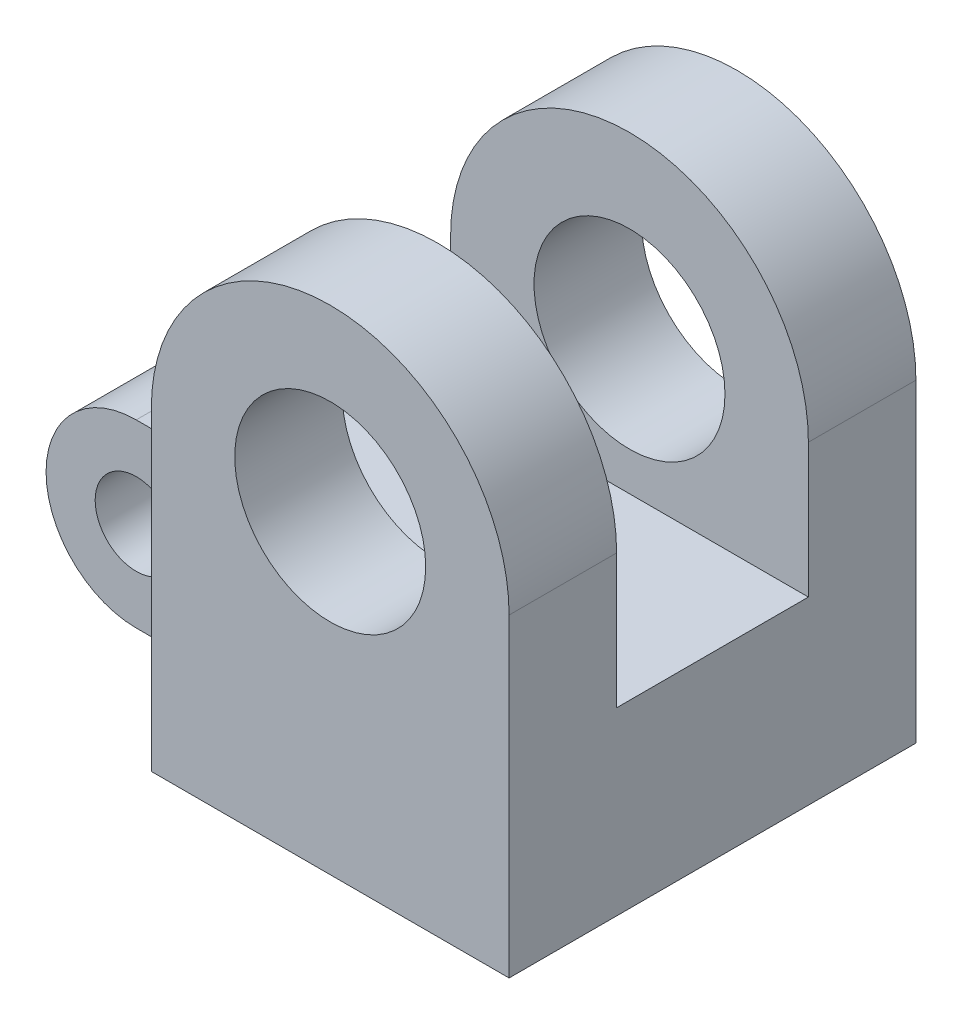
from build123d import *

# Parameters (mm, degrees)
EXTRUDE1_DEPTH     = 8.116924898
SKETCH2_W          = 56.161836645
SKETCH2_H          = 29.756220801
EXTRUDE2_DEPTH     = 3.825672251
SKETCH3_R          = 3.81
EXTRUDE3_DEPTH     = 22.721965672
SKETCH4_R          = 6.425
CUT_EXTRUDE1_DEPTH = 1.27
SKETCH6_R          = 1.638383055
EXTRUDE4_DEPTH     = 3.462479646
EXTRUDE5_DEPTH     = 24.392223233


with BuildPart() as part:
    # Sketch1 → Extrude1 (new, symmetric)
    with BuildSketch(Plane.XY):
        with BuildLine():
            Line((-7.138522943, -12.54381934), (-7.138522943, 0))
            ThreePointArc((-7.138522943, 0), (0, 7.138522943), (7.138522943, 0))
            Line((7.138522943, 0), (7.138522943, -12.54381934))
            Line((7.138522943, -12.54381934), (-7.138522943, -12.54381934))
        make_face()
    extrude(amount=EXTRUDE1_DEPTH, both=True)

    # Sketch2 → Extrude2 (cut, symmetric)
    with BuildSketch(Plane.XY):
        with Locations((-1.286243087, 9.527651968)):
            Rectangle(SKETCH2_W, SKETCH2_H)
    extrude(amount=EXTRUDE2_DEPTH, both=True, mode=Mode.SUBTRACT)

    # Sketch3 → Extrude3 (cut, through all)
    with BuildSketch(Plane.XY.offset(8.116924898)):
        Circle(SKETCH3_R)
    extrude(amount=-EXTRUDE3_DEPTH, mode=Mode.SUBTRACT)

    # Sketch4 → Cut-Extrude1 (cut)
    with BuildSketch(Plane.XZ.offset(12.54381934)):
        Circle(SKETCH4_R)
    extrude(amount=-CUT_EXTRUDE1_DEPTH, mode=Mode.SUBTRACT)

    # Sketch6 → Extrude4 (add, symmetric)
    with BuildSketch(Plane.XY):
        with BuildLine():
            Line((7.138522943, -12.54381934), (7.138522943, -5.350458433))
            Line((7.138522943, -5.350458433), (12.396008331, -5.350458433))
            ThreePointArc((12.396008331, -5.350458433), (15.992688785, -8.947138887), (12.396008331, -12.54381934))
            Line((12.396008331, -12.54381934), (7.138522943, -12.54381934))
        make_face()
        with Locations((12.396008331, -8.947138887)):
            Circle(SKETCH6_R, mode=Mode.SUBTRACT)
    extrude4 = extrude(amount=EXTRUDE4_DEPTH, both=True)

    # Mirror1: Extrude4 across plane
    add(extrude4.mirror(Plane(origin=(0, 0, 0), x_dir=(0, 0, 1), z_dir=(1, 0, 0))))

    # Sketch7 → Extrude5 (cut, through all)
    with BuildSketch(Plane.XY.offset(3.462479646)):
        with BuildLine():
            Line((7.138522943, -12.54381934), (12.396008331, -12.54381934))
            ThreePointArc((12.396008331, -12.54381934), (15.992688785, -8.947138887), (12.396008331, -5.350458433))
            Line((12.396008331, -5.350458433), (7.138522943, -5.350458433))
            Line((7.138522943, -5.350458433), (7.138522943, -12.54381934))
        make_face()
    extrude(amount=-EXTRUDE5_DEPTH, mode=Mode.SUBTRACT)


solid = part.part
